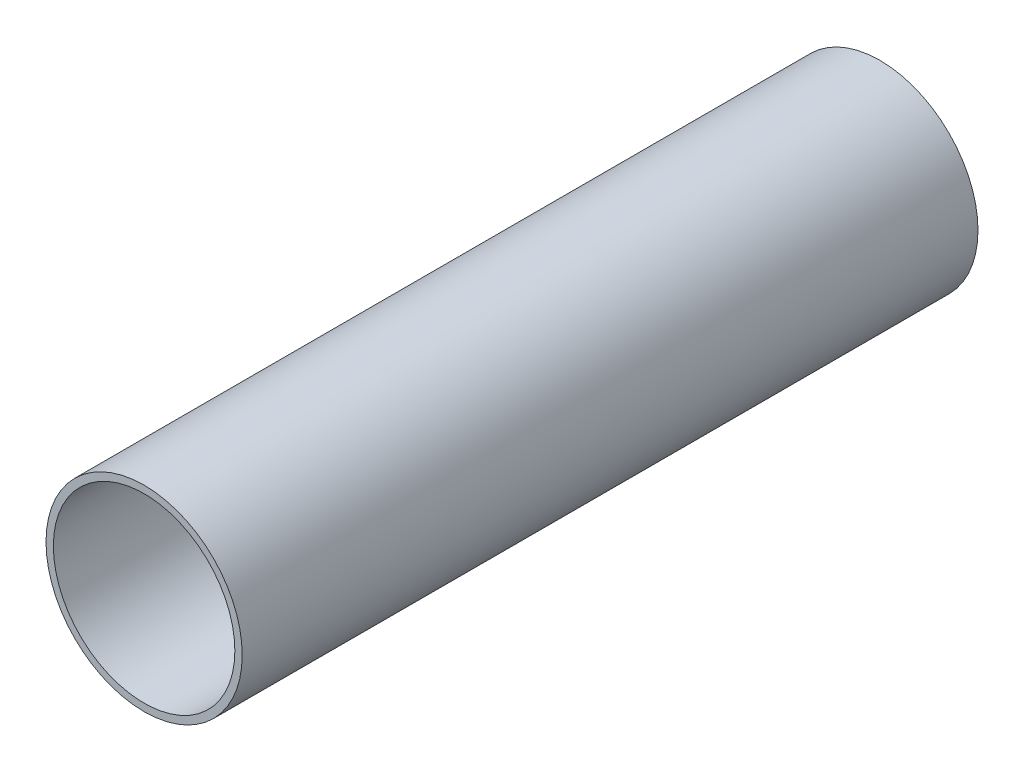
from build123d import *

# Parameters (mm, degrees)
SKETCH1_R           = 20
SKETCH1_R_2         = 18.5
BOSS_EXTRUDE1_DEPTH = 150


with BuildPart() as part:
    # Sketch1 → Boss-Extrude1 (new body)
    with BuildSketch(Plane.XY):
        Circle(SKETCH1_R)
        Circle(SKETCH1_R_2, mode=Mode.SUBTRACT)
    extrude(amount=BOSS_EXTRUDE1_DEPTH)


solid = part.part
